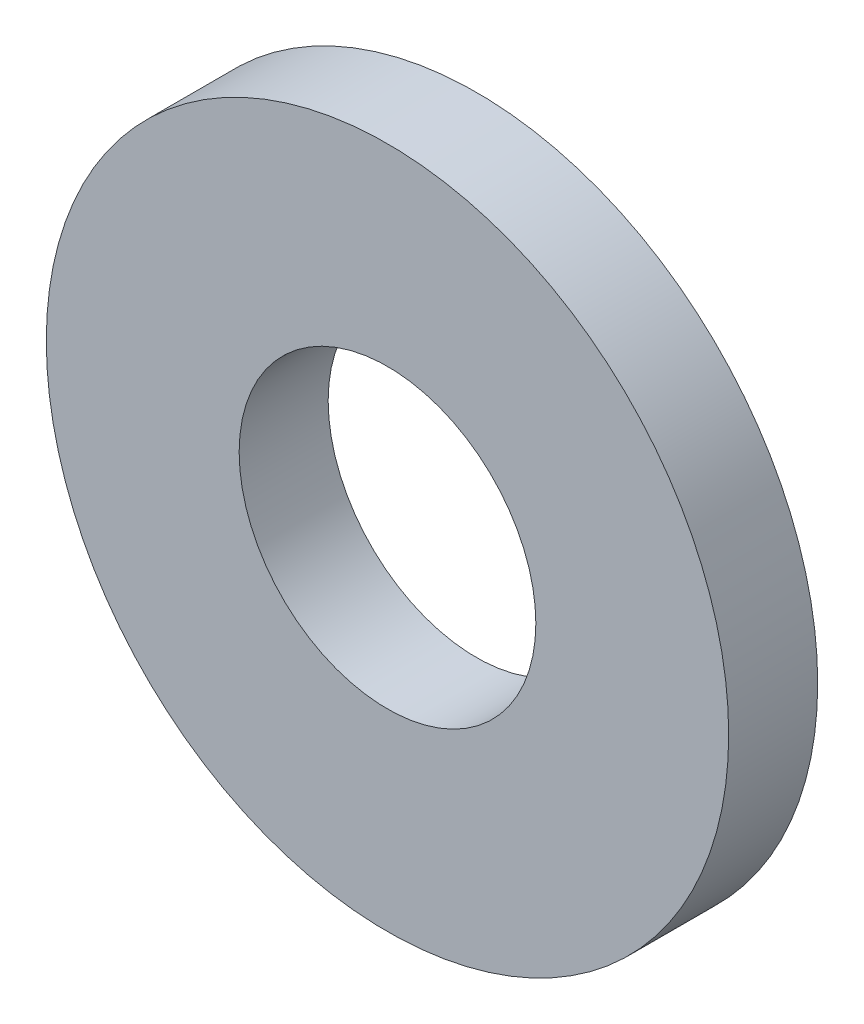
from build123d import *

# Parameters (mm, degrees)
SKETCH_1_R          = 11.5
EXTRUDE_1_DEPTH     = 2.3
SKETCH_2_R          = 11.5
EXTRUDE_2_DEPTH     = 0.7
SKETCH_3_R          = 5
CUT_EXTRUDE_1_DEPTH = 10


with BuildPart() as part:
    # 草图1 → 凸台-拉伸1 (new body)
    with BuildSketch(Plane.XY):
        Circle(SKETCH_1_R)
        Polygon((8, -3.175426481), (10.75, -1.58771324), (10.75, 1.58771324), (8, 3.175426481), (5.25, 1.58771324), (5.25, -1.58771324), align=None, mode=Mode.SUBTRACT)
        Polygon((3.175426481, 8), (1.58771324, 10.75), (-1.58771324, 10.75), (-3.175426481, 8), (-1.58771324, 5.25), (1.58771324, 5.25), align=None, mode=Mode.SUBTRACT)
        Polygon((-3.175426481, -8), (-1.58771324, -10.75), (1.58771324, -10.75), (3.175426481, -8), (1.58771324, -5.25), (-1.58771324, -5.25), align=None, mode=Mode.SUBTRACT)
        Polygon((-8, 3.175426481), (-10.75, 1.58771324), (-10.75, -1.58771324), (-8, -3.175426481), (-5.25, -1.58771324), (-5.25, 1.58771324), align=None, mode=Mode.SUBTRACT)
    extrude(amount=EXTRUDE_1_DEPTH)

    # 草图2 → 凸台-拉伸2 (add)
    with BuildSketch(Plane.XY.offset(2.3)):
        Circle(SKETCH_2_R)
    extrude(amount=EXTRUDE_2_DEPTH)

    # 草图3 → 切除-拉伸1 (cut)
    with BuildSketch(Plane.XY.offset(3)):
        Circle(SKETCH_3_R)
    extrude(amount=-CUT_EXTRUDE_1_DEPTH, mode=Mode.SUBTRACT)


solid = part.part
